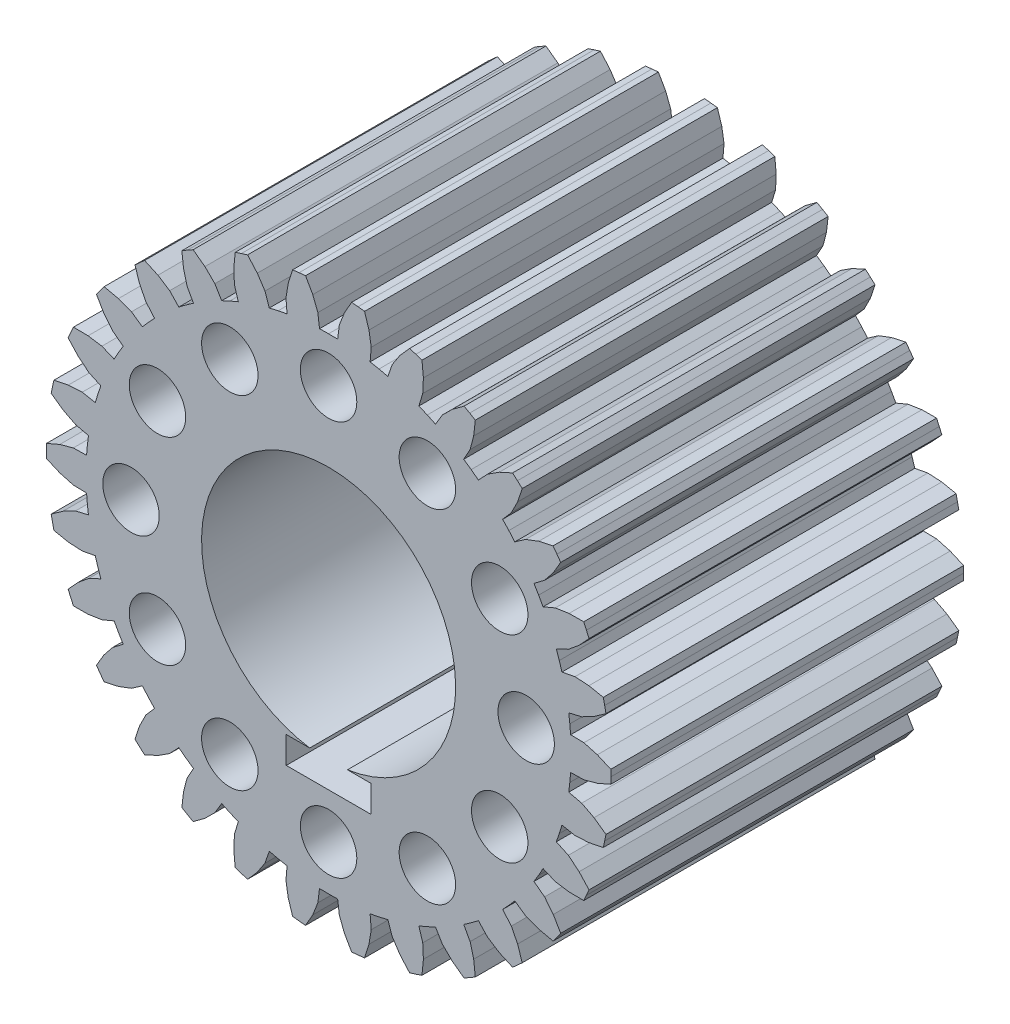
from build123d import *

# Parameters (mm, degrees)
SKETCH_1_R           = 9
F_01_GEAR_BODY_DEPTH = 25
SKETCH_2_R           = 2
F_02_HOLES_12_DEPTH  = 38.713890548
SKETCH_3_W           = 6
SKETCH_3_H           = 1.9
F_03_KEYWAY_DEPTH    = 38.713890548


with BuildPart() as part:
    # 草图1 → 01_GEAR_BODY (new body)
    with BuildSketch(Plane.XY):
        Polygon((17.148632401, -1.155232895), (18.089342219, -1.136363972), (19.04239454, -0.87528077), (19.994690091, -0.460834186), (20, 0), (19.994690091, 0.460834186), (19.04239454, 0.87528077), (18.089342219, 1.136363972), (17.148632401, 1.155232895), (17.093345077, 1.796582962), (17.014080063, 2.435412873), (17.930310045, 2.649454034), (18.808253637, 3.102982661), (19.653570955, 3.706365971), (19.562952015, 4.158233816), (19.461945325, 4.607893678), (18.444291427, 4.815290231), (17.457783336, 4.872517419), (16.533707214, 4.695389442), (16.346283874, 5.311229591), (16.135930784, 5.919619412), (16.987637283, 6.319478185), (17.752101797, 6.94563086), (18.45349646, 7.71158015), (18.270909153, 8.134732862), (18.07862016, 8.553566105), (17.040084273, 8.544848403), (16.063235549, 8.395718475), (15.196179685, 8.03033494), (14.884811628, 8.59375), (14.552563901, 9.145110177), (15.302523256, 9.713310815), (15.920097925, 10.484721661), (16.44691562, 11.379761272), (16.180339887, 11.755705046), (15.905172543, 12.125406648), (14.891143668, 11.900955697), (13.966647288, 11.551986345), (13.194506184, 11.014316267), (12.772801688, 11.500682297), (12.333180145, 11.970915745), (12.948615533, 12.682625153), (13.39230938, 13.565579815), (13.721525646, 14.55059222), (13.382612127, 14.86289651), (13.036592564, 15.167308737), (12.09138863, 14.73693412), (11.259649522, 14.20337698), (10.616169448, 13.51691912), (10.102559024, 13.904979591), (9.574777235, 14.273534851), (10.028791177, 15.097647914), (10.279212653, 16.053557036), (10.396439158, 17.085492467), (10, 17.320508076), (9.598250933, 17.546326653), (8.763181888, 16.928837806), (8.060551042, 16.234011886), (7.573855166, 15.428767747), (6.990786053, 15.701562553), (6.397910615, 15.952331993), (6.670660523, 16.852831014), (6.716865007, 17.83991678), (6.616978391, 18.873674708), (6.180339887, 19.021130326), (5.74041968, 19.158485898), (5.051982046, 18.380870046), (4.509167802, 17.555142572), (4.200527069, 16.666305187), (3.573482186, 16.811911888), (2.9414246, 16.933935679), (3.020989995, 17.87146453), (2.860958129, 18.846586557), (2.548323917, 19.836986798), (2.090569265, 19.890437907), (1.63170454, 19.933327376), (1.119986348, 19.029570064), (0.760712292, 18.10902929), (0.643615784, 17.175445117), (0, 17.1875), (-0.643615784, 17.175445117), (-0.760712292, 18.10902929), (-1.119986348, 19.029570064), (-1.63170454, 19.933327376), (-2.090569265, 19.890437907), (-2.548323917, 19.836986798), (-2.860958129, 18.846586557), (-3.020989995, 17.87146453), (-2.9414246, 16.933935679), (-3.573482186, 16.811911888), (-4.200527069, 16.666305187), (-4.509167802, 17.555142572), (-5.051982046, 18.380870046), (-5.74041968, 19.158485898), (-6.180339887, 19.021130326), (-6.616978391, 18.873674708), (-6.716865007, 17.83991678), (-6.670660523, 16.852831014), (-6.397910615, 15.952331993), (-6.990786053, 15.701562553), (-7.573855166, 15.428767747), (-8.060551042, 16.234011886), (-8.763181888, 16.928837806), (-9.598250933, 17.546326653), (-10, 17.320508076), (-10.396439158, 17.085492467), (-10.279212653, 16.053557036), (-10.028791177, 15.097647914), (-9.574777235, 14.273534851), (-10.102559024, 13.904979591), (-10.616169448, 13.51691912), (-11.259649522, 14.20337698), (-12.09138863, 14.73693412), (-13.036592564, 15.167308737), (-13.382612127, 14.86289651), (-13.721525646, 14.55059222), (-13.39230938, 13.565579815), (-12.948615533, 12.682625153), (-12.333180145, 11.970915745), (-12.772801688, 11.500682297), (-13.194506184, 11.014316267), (-13.966647288, 11.551986345), (-14.891143668, 11.900955697), (-15.905172543, 12.125406648), (-16.180339887, 11.755705046), (-16.44691562, 11.379761272), (-15.920097925, 10.484721661), (-15.302523256, 9.713310815), (-14.552563901, 9.145110177), (-14.884811628, 8.59375), (-15.196179685, 8.03033494), (-16.063235549, 8.395718475), (-17.040084273, 8.544848403), (-18.07862016, 8.553566105), (-18.270909153, 8.134732862), (-18.45349646, 7.71158015), (-17.752101797, 6.94563086), (-16.987637283, 6.319478185), (-16.135930784, 5.919619412), (-16.346283874, 5.311229591), (-16.533707214, 4.695389442), (-17.457783336, 4.872517419), (-18.444291427, 4.815290231), (-19.461945325, 4.607893678), (-19.562952015, 4.158233816), (-19.653570955, 3.706365971), (-18.808253637, 3.102982661), (-17.930310045, 2.649454034), (-17.014080063, 2.435412873), (-17.093345077, 1.796582962), (-17.148632401, 1.155232895), (-18.089342219, 1.136363972), (-19.04239454, 0.87528077), (-19.994690091, 0.460834186), (-20, 0), (-19.994690091, -0.460834186), (-19.04239454, -0.87528077), (-18.089342219, -1.136363972), (-17.148632401, -1.155232895), (-17.093345077, -1.796582962), (-17.014080063, -2.435412873), (-17.930310045, -2.649454034), (-18.808253637, -3.102982661), (-19.653570955, -3.706365971), (-19.562952015, -4.158233816), (-19.461945325, -4.607893678), (-18.444291427, -4.815290231), (-17.457783336, -4.872517419), (-16.533707214, -4.695389442), (-16.346283874, -5.311229591), (-16.135930784, -5.919619412), (-16.987637283, -6.319478185), (-17.752101797, -6.94563086), (-18.45349646, -7.71158015), (-18.270909153, -8.134732862), (-18.07862016, -8.553566105), (-17.040084273, -8.544848403), (-16.063235549, -8.395718475), (-15.196179685, -8.03033494), (-14.884811628, -8.59375), (-14.552563901, -9.145110177), (-15.302523256, -9.713310815), (-15.920097925, -10.484721661), (-16.44691562, -11.379761272), (-16.180339887, -11.755705046), (-15.905172543, -12.125406648), (-14.891143668, -11.900955697), (-13.966647288, -11.551986345), (-13.194506184, -11.014316267), (-12.772801688, -11.500682297), (-12.333180145, -11.970915745), (-12.948615533, -12.682625153), (-13.39230938, -13.565579815), (-13.721525646, -14.55059222), (-13.382612127, -14.86289651), (-13.036592564, -15.167308737), (-12.09138863, -14.73693412), (-11.259649522, -14.20337698), (-10.616169448, -13.51691912), (-10.102559024, -13.904979591), (-9.574777235, -14.273534851), (-10.028791177, -15.097647914), (-10.279212653, -16.053557036), (-10.396439158, -17.085492467), (-10, -17.320508076), (-9.598250933, -17.546326653), (-8.763181888, -16.928837806), (-8.060551042, -16.234011886), (-7.573855166, -15.428767747), (-6.990786053, -15.701562553), (-6.397910615, -15.952331993), (-6.670660523, -16.852831014), (-6.716865007, -17.83991678), (-6.616978391, -18.873674708), (-6.180339887, -19.021130326), (-5.74041968, -19.158485898), (-5.051982046, -18.380870046), (-4.509167802, -17.555142572), (-4.200527069, -16.666305187), (-3.573482186, -16.811911888), (-2.9414246, -16.933935679), (-3.020989995, -17.87146453), (-2.860958129, -18.846586557), (-2.548323917, -19.836986798), (-2.090569265, -19.890437907), (-1.63170454, -19.933327376), (-1.119986348, -19.029570064), (-0.760712292, -18.10902929), (-0.643615784, -17.175445117), (0, -17.1875), (0.643615784, -17.175445117), (0.760712292, -18.10902929), (1.119986348, -19.029570064), (1.63170454, -19.933327376), (2.090569265, -19.890437907), (2.548323917, -19.836986798), (2.860958129, -18.846586557), (3.020989995, -17.87146453), (2.9414246, -16.933935679), (3.573482186, -16.811911888), (4.200527069, -16.666305187), (4.509167802, -17.555142572), (5.051982046, -18.380870046), (5.74041968, -19.158485898), (6.180339887, -19.021130326), (6.616978391, -18.873674708), (6.716865007, -17.83991678), (6.670660523, -16.852831014), (6.397910615, -15.952331993), (6.990786053, -15.701562553), (7.573855166, -15.428767747), (8.060551042, -16.234011886), (8.763181888, -16.928837806), (9.598250933, -17.546326653), (10, -17.320508076), (10.396439158, -17.085492467), (10.279212653, -16.053557036), (10.028791177, -15.097647914), (9.574777235, -14.273534851), (10.102559024, -13.904979591), (10.616169448, -13.51691912), (11.259649522, -14.20337698), (12.09138863, -14.73693412), (13.036592564, -15.167308737), (13.382612127, -14.86289651), (13.721525646, -14.55059222), (13.39230938, -13.565579815), (12.948615533, -12.682625153), (12.333180145, -11.970915745), (12.772801688, -11.500682297), (13.194506184, -11.014316267), (13.966647288, -11.551986345), (14.891143668, -11.900955697), (15.905172543, -12.125406648), (16.180339887, -11.755705046), (16.44691562, -11.379761272), (15.920097925, -10.484721661), (15.302523256, -9.713310815), (14.552563901, -9.145110177), (14.884811628, -8.59375), (15.196179685, -8.03033494), (16.063235549, -8.395718475), (17.040084273, -8.544848403), (18.07862016, -8.553566105), (18.270909153, -8.134732862), (18.45349646, -7.71158015), (17.752101797, -6.94563086), (16.987637283, -6.319478185), (16.135930784, -5.919619412), (16.346283874, -5.311229591), (16.533707214, -4.695389442), (17.457783336, -4.872517419), (18.444291427, -4.815290231), (19.461945325, -4.607893678), (19.562952015, -4.158233816), (19.653570955, -3.706365971), (18.808253637, -3.102982661), (17.930310045, -2.649454034), (17.014080063, -2.435412873), (17.093345077, -1.796582962), align=None)
        Circle(SKETCH_1_R, mode=Mode.SUBTRACT)
    extrude(amount=F_01_GEAR_BODY_DEPTH)

    # 草图2 → 02_HOLES_12 (cut, through all)
    with BuildSketch(Plane.XY):
        with Locations((0, 14)):
            Circle(SKETCH_2_R)
        with Locations((-7, 12.124355653)):
            Circle(SKETCH_2_R)
        with Locations((-12.124355653, 7)):
            Circle(SKETCH_2_R)
        with Locations((-14, 0)):
            Circle(SKETCH_2_R)
        with Locations((-12.124355653, -7)):
            Circle(SKETCH_2_R)
        with Locations((-7, -12.124355653)):
            Circle(SKETCH_2_R)
        with Locations((0, -14)):
            Circle(SKETCH_2_R)
        with Locations((7, -12.124355653)):
            Circle(SKETCH_2_R)
        with Locations((12.124355653, -7)):
            Circle(SKETCH_2_R)
        with Locations((14, 0)):
            Circle(SKETCH_2_R)
        with Locations((12.124355653, 7)):
            Circle(SKETCH_2_R)
        with Locations((7, 12.124355653)):
            Circle(SKETCH_2_R)
    extrude(amount=F_02_HOLES_12_DEPTH, mode=Mode.SUBTRACT)

    # 草图3 → 03_KEYWAY (cut, through all)
    with BuildSketch(Plane.XY):
        with Locations((0, -9.85)):
            Rectangle(SKETCH_3_W, SKETCH_3_H)
    extrude(amount=F_03_KEYWAY_DEPTH, mode=Mode.SUBTRACT)


solid = part.part
